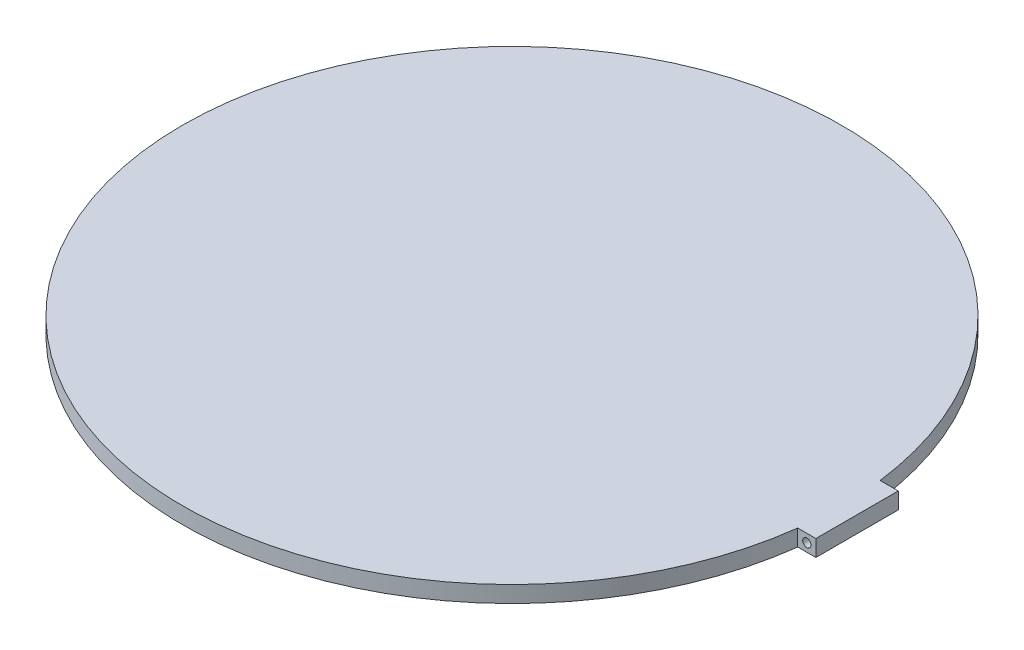
from build123d import *

# Parameters (mm, degrees)
BOSS_EXTRUDE1_DEPTH = 2.54
SKETCH2_R           = 0.635
CUT_EXTRUDE1_DEPTH  = 119.691411293


with BuildPart() as part:
    # Sketch1 → Boss-Extrude1 (new body)
    with BuildSketch(Plane(origin=(0, 0, 0), x_dir=(1, 0, 0), z_dir=(0, 1, 0))):
        with BuildLine():
            Line((0, 0), (0, 12.7))
            Line((0, 12.7), (-2.794, 12.7))
            ThreePointArc((-2.794, 12.7), (-103.995562476, 6.35), (-2.794, 0))
            Line((-2.794, 0), (0, 0))
        make_face()
    extrude(amount=BOSS_EXTRUDE1_DEPTH)

    # Sketch2 → Cut-Extrude1 (cut, through all)
    with BuildSketch(Plane.XY):
        with Locations((-1.397, 1.27)):
            Circle(SKETCH2_R)
    extrude(amount=-CUT_EXTRUDE1_DEPTH, mode=Mode.SUBTRACT)


solid = part.part
